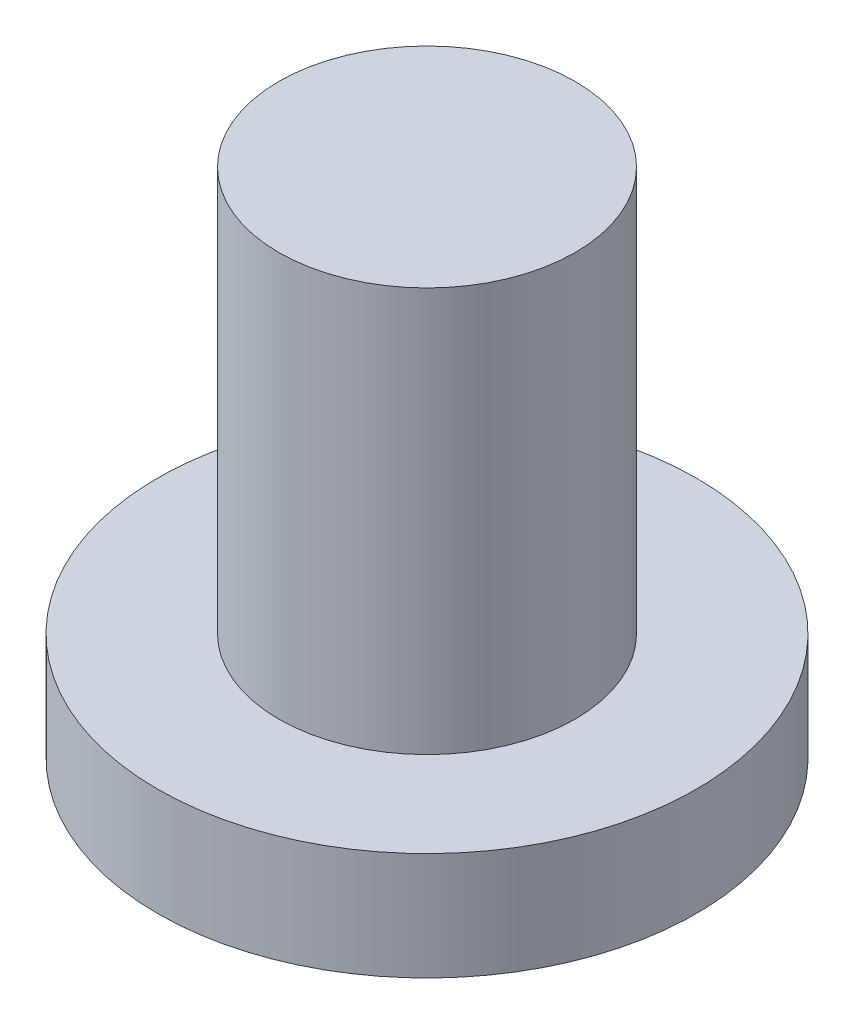
from build123d import *

# Parameters (mm, degrees)
ESBO_O1_R                = 2
RESSALTO_EXTRUS_O1_DEPTH = 0.8
ESBO_O2_R                = 1.1
RESSALTO_EXTRUS_O2_DEPTH = 3


with BuildPart() as part:
    # Esboço1 → Ressalto-extrusão1 (new body)
    with BuildSketch(Plane(origin=(0, 0, 0), x_dir=(1, 0, 0), z_dir=(0, 1, 0))):
        with Locations(Location((0, 0, 0), (0, 0, 270))):
            Circle(ESBO_O1_R)
    extrude(amount=RESSALTO_EXTRUS_O1_DEPTH)

    # Esboço2 → Ressalto-extrusão2 (add)
    with BuildSketch(Plane(origin=(0, 0.8, 0), x_dir=(1, 0, 0), z_dir=(0, 1, 0))):
        with Locations(Location((0, 0, 0), (0, 0, 270))):
            Circle(ESBO_O2_R)
    extrude(amount=RESSALTO_EXTRUS_O2_DEPTH)


solid = part.part
